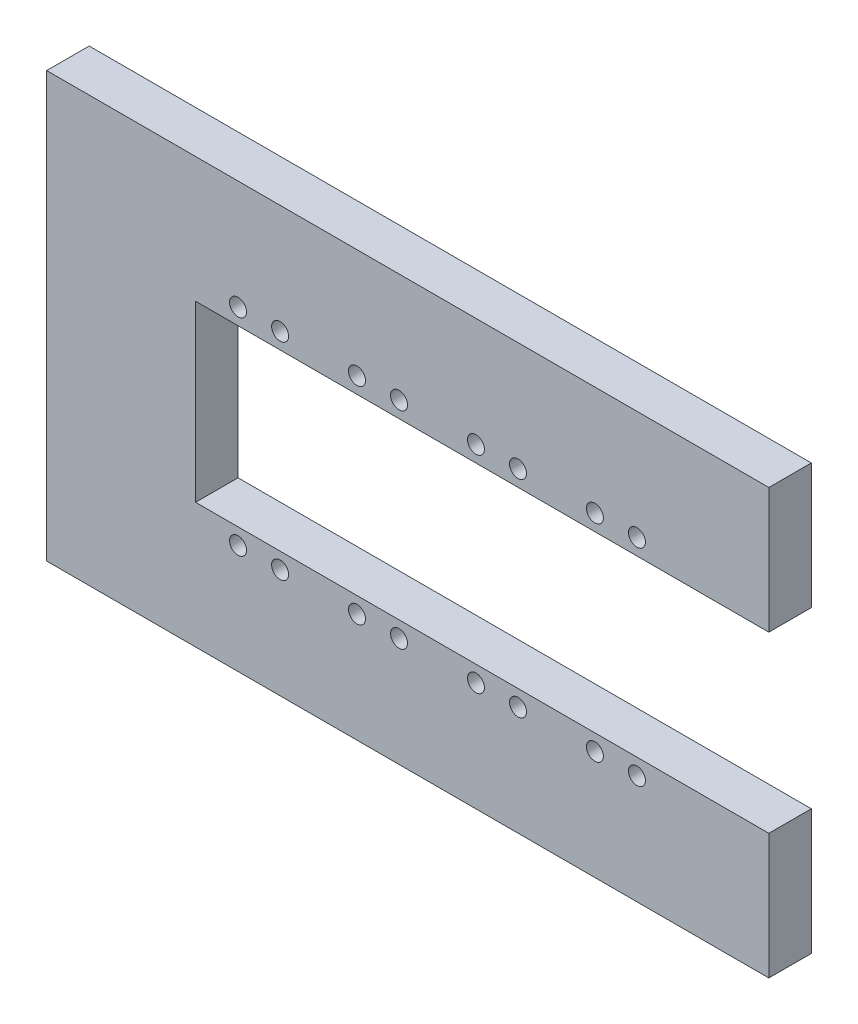
from build123d import *

# Parameters (mm, degrees)
SKETCH7_W           = 170
SKETCH7_H           = 100
BOSS_EXTRUDE1_DEPTH = 10
SKETCH1_R           = 2
CUT_EXTRUDE2_DEPTH  = 131.384048104
LPATTERN1_COUNT     = 4
LPATTERN1_PITCH     = 28
SKETCH8_W           = 134.95
SKETCH8_H           = 41
CUT_EXTRUDE3_DEPTH  = 131.384048104


with BuildPart() as part:
    # Sketch7 → Boss-Extrude1 (new body)
    with BuildSketch(Plane.XY):
        with Locations((35, 0)):
            Rectangle(SKETCH7_W, SKETCH7_H)
    extrude(amount=-BOSS_EXTRUDE1_DEPTH)

    # Sketch1 → Cut-Extrude2 (cut, through all)
    with BuildSketch(Plane.XY):
        with Locations((4.95, -24.3)):
            Circle(SKETCH1_R)
        with Locations(Location((-4.95, -24.3, 0), (0, 0, 180))):
            Circle(SKETCH1_R)
        with Locations((-4.95, 24.3)):
            Circle(SKETCH1_R)
        with Locations(Location((4.95, 24.3, 0), (0, 0, 180))):
            Circle(SKETCH1_R)
    cut_extrude2 = extrude(amount=-CUT_EXTRUDE2_DEPTH, mode=Mode.SUBTRACT)

    # LPattern1: Cut-Extrude2 ×4
    with Locations(*[(i * LPATTERN1_PITCH, 0, 0) for i in range(1, LPATTERN1_COUNT)]):
        add(cut_extrude2, mode=Mode.SUBTRACT)

    # Sketch8 → Cut-Extrude3 (cut, through all)
    with BuildSketch(Plane.XY):
        with Locations((52.525, 0)):
            Rectangle(SKETCH8_W, SKETCH8_H)
    extrude(amount=-CUT_EXTRUDE3_DEPTH, mode=Mode.SUBTRACT)


solid = part.part
